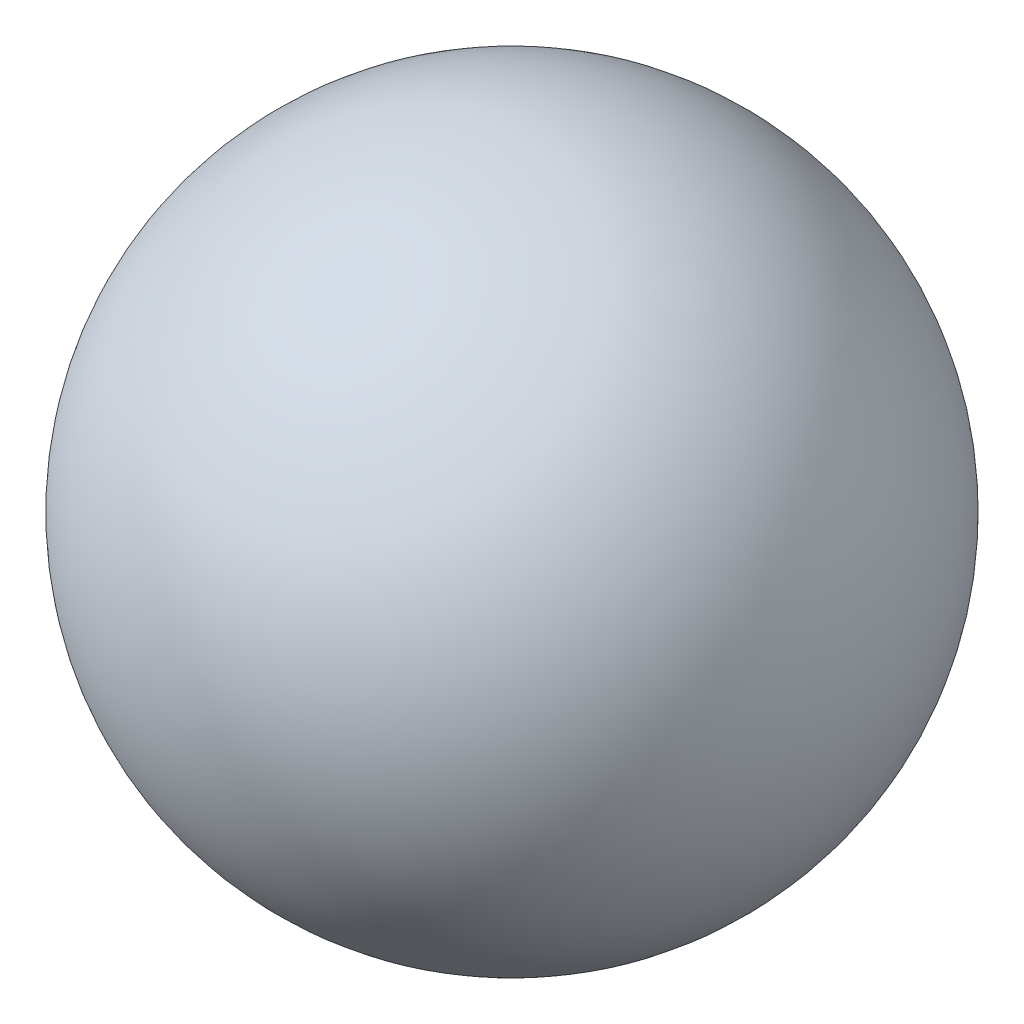
from build123d import *


with BuildPart() as part:
    # 草图1 → 旋转1 (revolve)
    with BuildSketch(Plane(origin=(0, 0, 0), x_dir=(0, 0, -1), z_dir=(1, 0, 0))):
        with BuildLine():
            Line((0, 8.5), (0, -8.5))
            ThreePointArc((0, -8.5), (8.5, 0), (0, 8.5))
        make_face()
    revolve(axis=Axis((0, 8.5, 0), (0, -1, 0)))


solid = part.part
